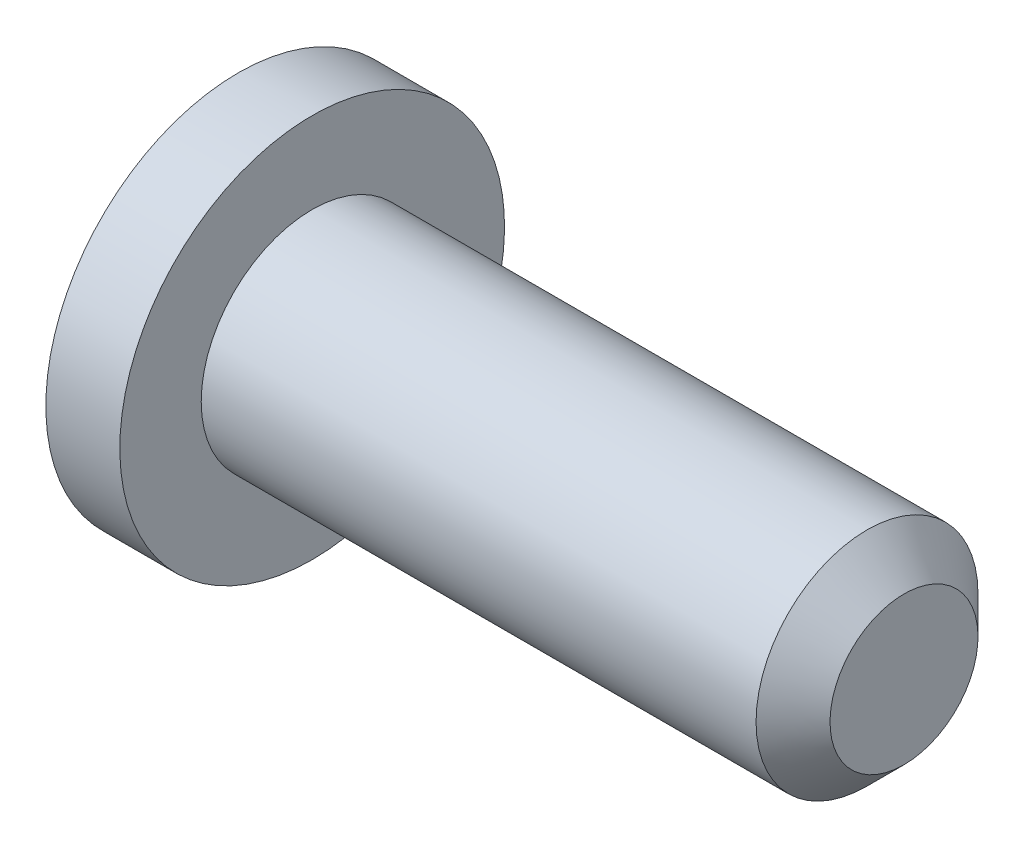
from build123d import *

# Parameters (mm, degrees)
CUT_EXTRUDE_1_DEPTH = 4.5
CHAMFER_1_SIZE      = 0.5


with BuildPart() as part:
    # Эскиз1 → Повернуть1 (revolve)
    with BuildSketch(Plane.XY, mode=Mode.PRIVATE) as revolve_1_sk:
        with BuildLine():
            Line((-8, 1.5), (0, 1.5))
            Line((0, 1.5), (0, 0))
            Line((0, 0), (-9.729168699, 0))
            ThreePointArc((-9.729168699, 0), (-9.543426508, 1.350156194), (-9, 2.6))
            Line((-9, 2.6), (-8, 2.6))
            Line((-8, 2.6), (-8, 1.5))
        make_face()
    revolve(revolve_1_sk.sketch.rotate(Axis((-9.729168699, 0, 0), (1, 0, 0)), 180), axis=Axis((-9.729168699, 0, 0), (1, 0, 0)))

    # Эскиз3 → Вырез-Вытянуть1 (cut)
    with BuildSketch(Plane(origin=(-13, 0, 0), x_dir=(0, 0, -1), z_dir=(1, 0, 0))):
        Polygon((-0.25, 0.25), (-0.25, 1.5), (0.25, 1.5), (0.25, 0.25), (1.5, 0.25), (1.5, -0.25), (0.25, -0.25), (0.25, -1.5), (-0.25, -1.5), (-0.25, -0.25), (-1.5, -0.25), (-1.5, 0.25), align=None)
    extrude(amount=CUT_EXTRUDE_1_DEPTH, mode=Mode.SUBTRACT)

    # Фаска1
    chamfer_1_edges = [part.edges().sort_by_distance(p)[0] for p in [
        (0, 1.5, 0),
    ]]
    chamfer(chamfer_1_edges, length=CHAMFER_1_SIZE)


solid = part.part
